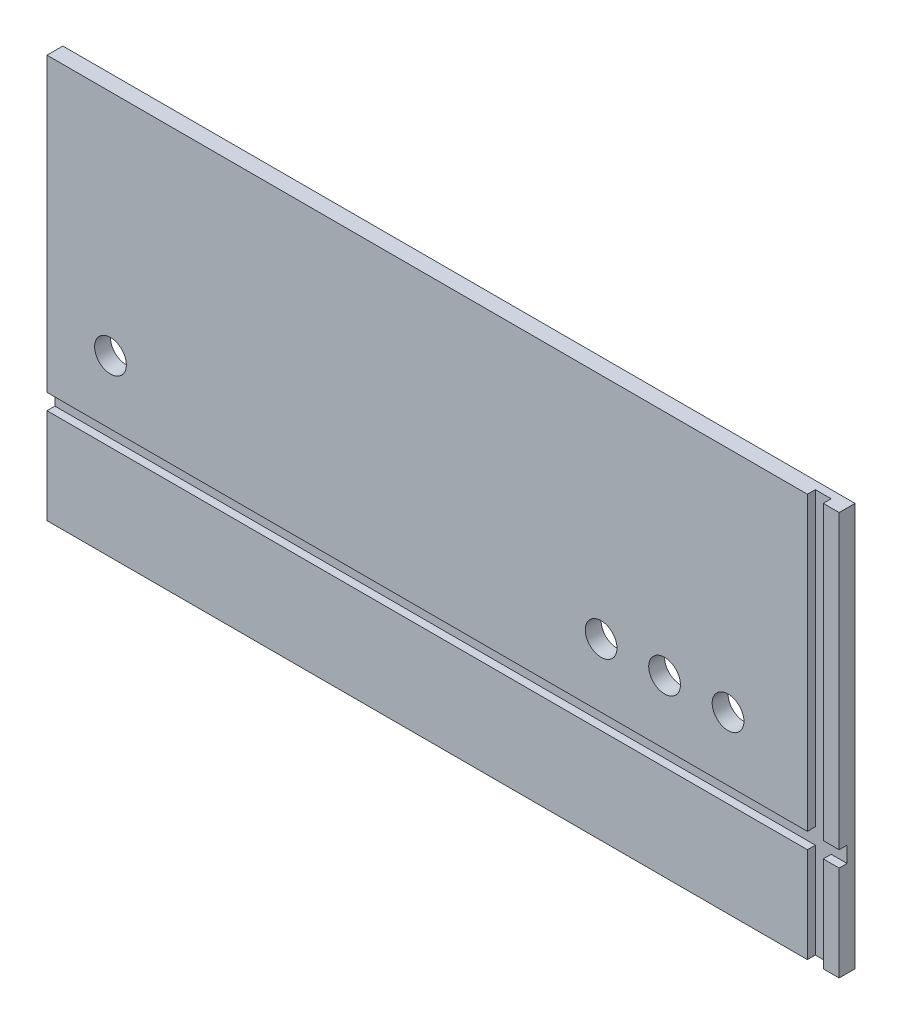
from build123d import *

# Parameters (mm, degrees)
BOSS_EXTRUDE1_DEPTH = 3.175
SKETCH2_W           = 1.5875
SKETCH2_H           = 3.175
CUT_EXTRUDE1_DEPTH  = 170.414546822
SKETCH3_R           = 3.175
CUT_EXTRUDE2_DEPTH  = 170.414546822
BOSS_EXTRUDE2_DEPTH = 9.525
SKETCH5_W           = 3.175
SKETCH5_H           = 80.645
CUT_EXTRUDE3_DEPTH  = 1.5875


with BuildPart() as part:
    # Sketch1 → Boss-Extrude1 (new body)
    with BuildSketch(Plane.XY):
        Polygon((89.265, 0), (148.955, 0), (148.955, 80.645), (0, 80.645), (0, 0), align=None)
    extrude(amount=BOSS_EXTRUDE1_DEPTH)

    # Sketch2 → Cut-Extrude1 (cut, through all)
    with BuildSketch(Plane(origin=(148.955, 0, 0), x_dir=(0, 0, -1), z_dir=(1, 0, 0))):
        with Locations((-2.38125, 20.6375)):
            Rectangle(SKETCH2_W, SKETCH2_H)
    extrude(amount=-CUT_EXTRUDE1_DEPTH, mode=Mode.SUBTRACT)

    # Sketch3 → Cut-Extrude2 (cut, through all)
    with BuildSketch(Plane.XY.offset(3.175)):
        with Locations((12.7, 34.925)):
            Circle(SKETCH3_R)
        with Locations((136.255, 34.925)):
            Circle(SKETCH3_R)
        with Locations((123.555, 34.925)):
            Circle(SKETCH3_R)
        with Locations((110.855, 34.925)):
            Circle(SKETCH3_R)
    extrude(amount=-CUT_EXTRUDE2_DEPTH, mode=Mode.SUBTRACT)

    # Sketch4 → Boss-Extrude2 (add)
    with BuildSketch(Plane(origin=(148.955, 0, 0), x_dir=(0, 0, -1), z_dir=(1, 0, 0))):
        Polygon((-3.175, 19.05), (-3.175, 0), (0, 0), (0, 80.645), (-3.175, 80.645), (-3.175, 22.225), (-1.5875, 22.225), (-1.5875, 19.05), align=None)
    extrude(amount=BOSS_EXTRUDE2_DEPTH)

    # Sketch5 → Cut-Extrude3 (cut)
    with BuildSketch(Plane.XY.offset(3.175)):
        with Locations((153.7175, 40.3225)):
            Rectangle(SKETCH5_W, SKETCH5_H)
    extrude(amount=-CUT_EXTRUDE3_DEPTH, mode=Mode.SUBTRACT)


solid = part.part
